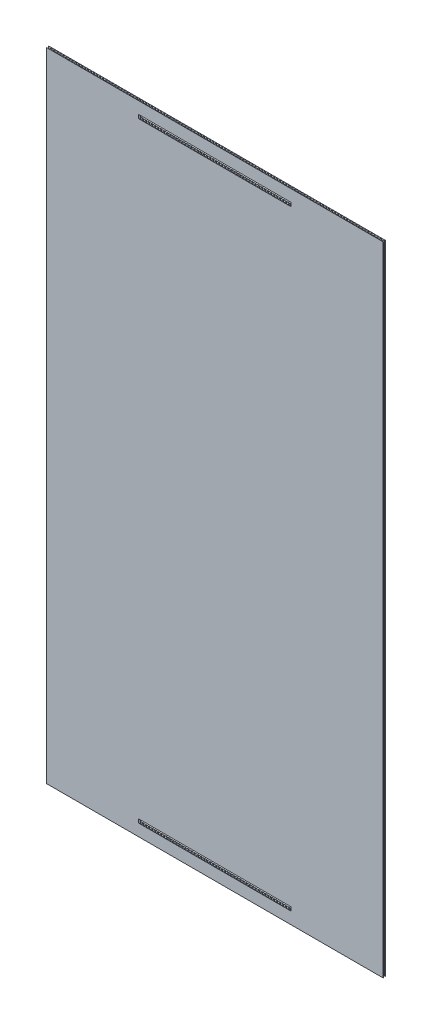
from build123d import *

# Parameters (mm, degrees)
BOSS_EXTRUDE1_DEPTH = 2090
LPATTERN1_COUNT     = 111
LPATTERN1_PITCH     = 10
SKETCH2_W           = 500.2
SKETCH2_H           = 12.1
SKETCH2_W_2         = 6
SKETCH2_H_2         = 2090
CUT_EXTRUDE1_DEPTH  = 2365.14656906
LPATTERN2_COUNT     = 2
LPATTERN2_PITCH     = 2000


with BuildPart() as part:
    # Sketch1 → Boss-Extrude1 (new body)
    with BuildSketch(Plane(origin=(0, 0, 0), x_dir=(1, 0, 0), z_dir=(0, 1, 0))):
        Polygon((5, -4), (-5.3, -4), (-5.3, -3.7), (4.7, -3.7), (4.7, 3.7), (-5.3, 3.7), (-5.3, 4), (5, 4), align=None)
    boss_extrude1 = extrude(amount=BOSS_EXTRUDE1_DEPTH)

    # LPattern1: Boss-Extrude1 ×111
    with Locations(*[(i * LPATTERN1_PITCH, 0, 0) for i in range(1, LPATTERN1_COUNT)]):
        add(boss_extrude1)

    # Sketch2 → Cut-Extrude1 (cut, through all)
    with BuildSketch(Plane.XY.offset(4)):
        with Locations((546.85, 44.95)):
            Rectangle(SKETCH2_W, SKETCH2_H)
        with Locations((1102, 1045)):
            Rectangle(SKETCH2_W_2, SKETCH2_H_2)
    cut_extrude1 = extrude(amount=-CUT_EXTRUDE1_DEPTH, mode=Mode.SUBTRACT)

    # LPattern2: Cut-Extrude1 ×2
    with Locations(*[(0, i * LPATTERN2_PITCH, 0) for i in range(1, LPATTERN2_COUNT)]):
        add(cut_extrude1, mode=Mode.SUBTRACT)


solid = part.part
